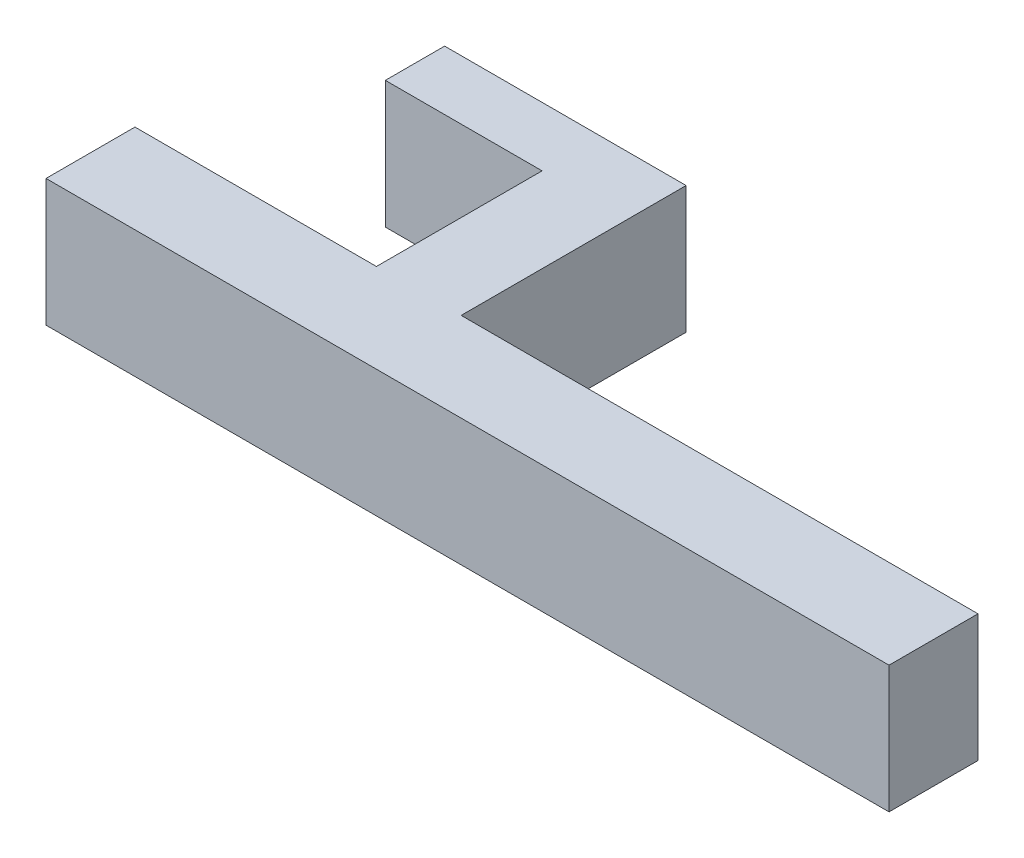
from build123d import *

# Parameters (mm, degrees)
RESSALTO_EXTRUS_O1_DEPTH = 3


with BuildPart() as part:
    # Esboço1 → Ressalto-extrusão1 (new body)
    with BuildSketch(Plane(origin=(0, 0, 0), x_dir=(1, 0, 0), z_dir=(0, 1, 0))):
        Polygon((0, 2.3), (0, 0.2), (19.9, 0.2), (19.9, 2.3), (7.7, 2.3), (7.7, 2.5), (7.7, 7.61), (2, 7.61), (2, 6.21), (5.7, 6.21), (5.7, 5.91), (5.7, 2.5), (5.7, 2.3), align=None)
    extrude(amount=RESSALTO_EXTRUS_O1_DEPTH)


solid = part.part
